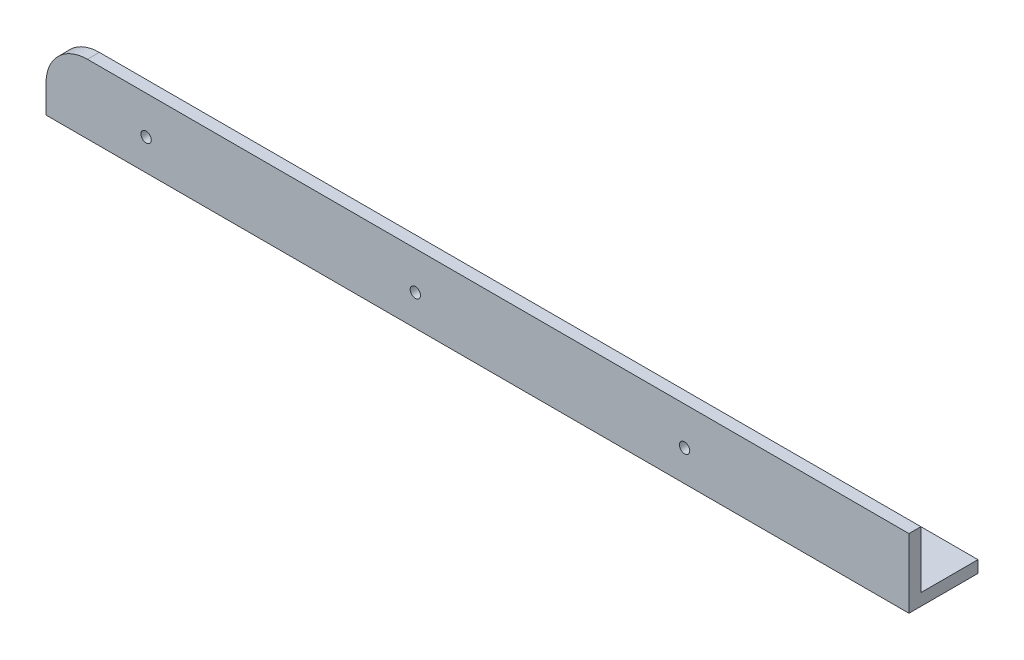
from build123d import *

# Parameters (mm, degrees)
BOSS_EXTRUDE1_DEPTH = 250
SKETCH2_R           = 1.5
CUT_EXTRUDE1_DEPTH  = 252.594912508
SKETCH3_R           = 1.5
CUT_EXTRUDE2_DEPTH  = 252.594912508


with BuildPart() as part:
    # Sketch1 → Boss-Extrude1 (new body)
    with BuildSketch(Plane(origin=(0, 0, 0), x_dir=(0, 0, -1), z_dir=(1, 0, 0))):
        Polygon((0, 0), (20, 0), (20, 3.461178467), (3.461178467, 3.461178467), (3.461178467, 20), (0, 20), align=None)
    extrude(amount=BOSS_EXTRUDE1_DEPTH)

    # Sketch2 → Cut-Extrude1 (cut, through all)
    with BuildSketch(Plane.XZ):
        with Locations(Location((130, -10, 0), (0, 0, 270))):
            Circle(SKETCH2_R)
        with Locations(Location((34, -10, 0), (0, 0, 270))):
            Circle(SKETCH2_R)
        with Locations(Location((226, -10, 0), (0, 0, 270))):
            Circle(SKETCH2_R)
        Polygon((0, 0), (20, -20), (0, -20), align=None)
    extrude(amount=-CUT_EXTRUDE1_DEPTH, mode=Mode.SUBTRACT)

    # Sketch3 → Cut-Extrude2 (cut, through all)
    with BuildSketch(Plane.XY):
        with Locations((29, 9)):
            Circle(SKETCH3_R)
        with Locations((107, 9)):
            Circle(SKETCH3_R)
        with Locations((185, 9)):
            Circle(SKETCH3_R)
        with BuildLine():
            Line((12, 20), (0, 20))
            Line((0, 20), (0, 8))
            ThreePointArc((0, 8), (3.514718626, 16.485281374), (12, 20))
        make_face()
    extrude(amount=-CUT_EXTRUDE2_DEPTH, mode=Mode.SUBTRACT)


solid = part.part
